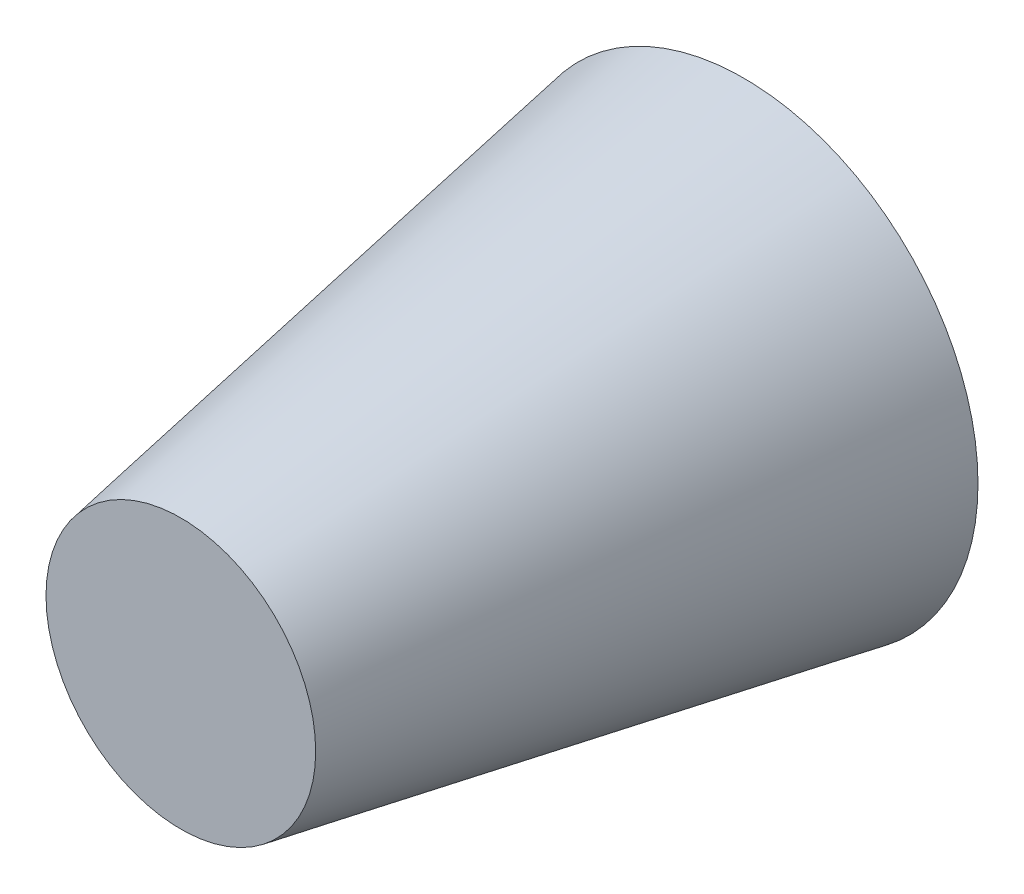
from build123d import *

# Parameters (mm, degrees)
SKETCH1_R           = 20.790129494
BOSS_EXTRUDE1_DEPTH = 50
BOSS_EXTRUDE1_TAPER = 10


with BuildPart() as part:
    # Sketch1 → Boss-Extrude1 (new body)
    with BuildSketch(Plane.XY):
        with Locations((0, 40.762481199)):
            Circle(SKETCH1_R)
    extrude(amount=BOSS_EXTRUDE1_DEPTH, taper=BOSS_EXTRUDE1_TAPER)


solid = part.part
